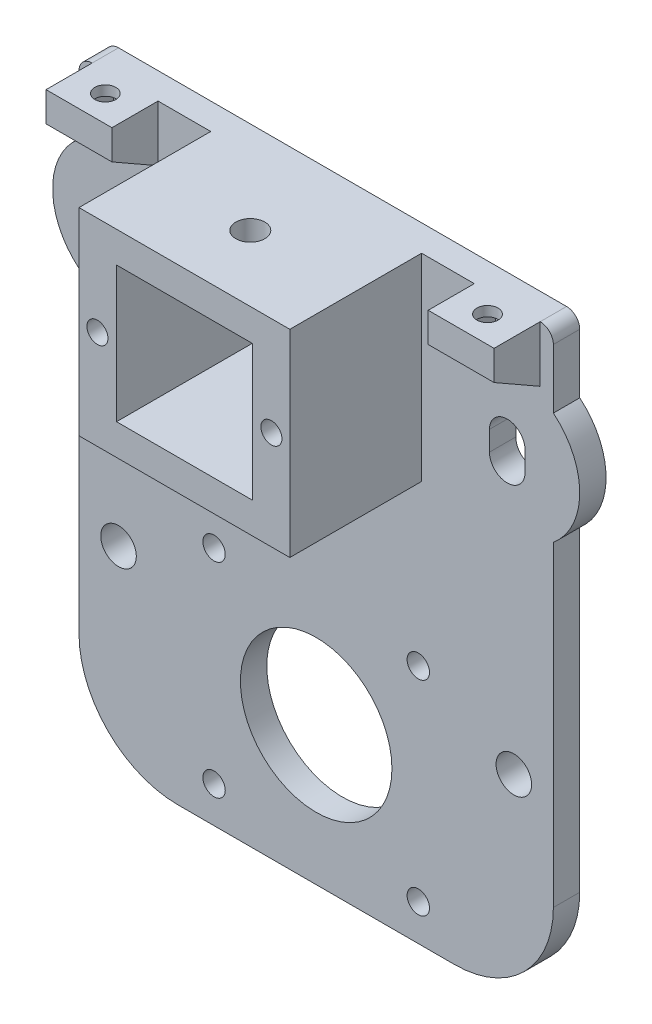
from build123d import *

# Parameters (mm, degrees)
SKETCH_1_R          = 1.7
SKETCH_1_R_2        = 11.5
SKETCH_1_R_3        = 2.7
SKETCH_1_R_4        = 1.6
SKETCH_1_W          = 20.6
SKETCH_1_H          = 20.6
EXTRUDE_1_DEPTH     = 4
EXTRUDE_START       = 4
SKETCH_1_3_W        = 10
SKETCH_1_3_H        = 4.5
EXTRUDE_2_DEPTH     = 7
SKETCH_1_4_W        = 32
SKETCH_1_4_H        = 30
SKETCH_1_4_R        = 1.6
SKETCH_1_4_W_2      = 20.6
SKETCH_1_4_H_2      = 20.6
EXTRUDE_3_DEPTH     = 20
RIB_1_REACH         = 94.748
SKETCH_3_WALL_W     = 195.558888446
SKETCH_3_WALL_H     = 1.7
RIB_2_REACH         = 86.984
SKETCH_4_WALL_W     = 180.029901728
SKETCH_4_WALL_H     = 1.7
CUT_EXTRUDE_1_REACH = 104.259
SKETCH_5_R          = 2.2
SKETCH_5_R_2        = 1.6
CUT_EXTRUDE_2_DEPTH = 3


with BuildPart() as part:
    # 草图1 → 凸台-拉伸1 (new body)
    with BuildSketch(Plane.XY):
        with BuildLine():
            ThreePointArc((36, 48.5), (35.414213562, 49.914213562), (34, 50.5))
            Line((34, 50.5), (-34, 50.5))
            ThreePointArc((-34, 50.5), (-35.414213562, 49.914213562), (-36, 48.5))
            Line((-36, 48.5), (-36, 39.485281374))
            ThreePointArc((-36, 39.485281374), (-40, 31), (-36, 22.514718626))
            Line((-36, 22.514718626), (-36, -25.5))
            ThreePointArc((-36, -25.5), (-31.606601718, -36.106601718), (-21, -40.5))
            Line((-21, -40.5), (21, -40.5))
            ThreePointArc((21, -40.5), (31.606601718, -36.106601718), (36, -25.5))
            Line((36, -25.5), (36, 22.514718626))
            ThreePointArc((36, 22.514718626), (40, 31), (36, 39.485281374))
            Line((36, 39.485281374), (36, 48.5))
        make_face()
        with Locations((-15.5, -35)):
            Circle(SKETCH_1_R, mode=Mode.SUBTRACT)
        with Locations((15.5, -35)):
            Circle(SKETCH_1_R, mode=Mode.SUBTRACT)
        with Locations((0, -19.5)):
            Circle(SKETCH_1_R_2, mode=Mode.SUBTRACT)
        with Locations((-30, -11)):
            Circle(SKETCH_1_R_3, mode=Mode.SUBTRACT)
        with Locations((-15.5, -4)):
            Circle(SKETCH_1_R, mode=Mode.SUBTRACT)
        with Locations((30, -11)):
            Circle(SKETCH_1_R_3, mode=Mode.SUBTRACT)
        with Locations((15.5, -4)):
            Circle(SKETCH_1_R, mode=Mode.SUBTRACT)
        with BuildLine():
            Line((-26.3, 32.5), (-26.3, 29.5))
            ThreePointArc((-26.3, 29.5), (-29, 26.8), (-31.7, 29.5))
            Line((-31.7, 29.5), (-31.7, 32.5))
            ThreePointArc((-31.7, 32.5), (-29, 35.2), (-26.3, 32.5))
        make_face(mode=Mode.SUBTRACT)
        with BuildLine():
            Line((31.7, 32.5), (31.7, 29.5))
            ThreePointArc((31.7, 29.5), (29, 26.8), (26.3, 29.5))
            Line((26.3, 29.5), (26.3, 32.5))
            ThreePointArc((26.3, 32.5), (29, 35.2), (31.7, 32.5))
        make_face(mode=Mode.SUBTRACT)
        with Locations((13.2, 35.5)):
            Circle(SKETCH_1_R_4, mode=Mode.SUBTRACT)
        with Locations((0, 35.5)):
            Rectangle(SKETCH_1_W, SKETCH_1_H, mode=Mode.SUBTRACT)
        with Locations((-13.2, 35.5)):
            Circle(SKETCH_1_R_4, mode=Mode.SUBTRACT)
    extrude(amount=EXTRUDE_1_DEPTH)

    # 草图1<3> → 凸台-拉伸2 (add)
    with BuildSketch(Plane.XY.offset(EXTRUDE_START)):
        with Locations((-29, 48.25)):
            Rectangle(SKETCH_1_3_W, SKETCH_1_3_H)
        with Locations((29, 48.25)):
            Rectangle(SKETCH_1_3_W, SKETCH_1_3_H)
    extrude(amount=EXTRUDE_2_DEPTH)

    # 草图1<4> → 凸台-拉伸3 (add)
    with BuildSketch(Plane.XY.offset(EXTRUDE_START)):
        with Locations((0, 35.5)):
            Rectangle(SKETCH_1_4_W, SKETCH_1_4_H)
        with Locations((-13.2, 35.5)):
            Circle(SKETCH_1_4_R, mode=Mode.SUBTRACT)
        with Locations((0, 35.5)):
            Rectangle(SKETCH_1_4_W_2, SKETCH_1_4_H_2, mode=Mode.SUBTRACT)
        with Locations((13.2, 35.5)):
            Circle(SKETCH_1_4_R, mode=Mode.SUBTRACT)
    extrude(amount=EXTRUDE_3_DEPTH)

    # 草图3 wall → 筋1 (add, up to next)
    with BuildSketch(Plane(origin=(-34, 44, 7.5), x_dir=(0, -0.496138938357, -0.868243142124), z_dir=(0, -0.868243142124, 0.496138938357)), mode=Mode.PRIVATE) as rib_1_sk1:
        with Locations((0, 0.85)):
            Rectangle(SKETCH_3_WALL_W, SKETCH_3_WALL_H)
    rib_1_tool1 = extrude(rib_1_sk1.sketch, amount=-RIB_1_REACH, mode=Mode.PRIVATE) - part.part
    rib_1 = rib_1_tool1.solids().sort_by_distance((-34, 44, 7.5))[0]
    add(rib_1)

    # 草图4 wall → 筋2 (add, up to next)
    with BuildSketch(Plane(origin=(-24, 44, 7.5), x_dir=(0, -0.496138938357, -0.868243142124), z_dir=(0, 0.868243142124, -0.496138938357)), mode=Mode.PRIVATE) as rib_2_sk1:
        with Locations((0, 0.85)):
            Rectangle(SKETCH_4_WALL_W, SKETCH_4_WALL_H)
    rib_2_tool1 = extrude(rib_2_sk1.sketch, amount=RIB_2_REACH, mode=Mode.PRIVATE) - part.part
    rib_2 = rib_2_tool1.solids().sort_by_distance((-24, 44, 7.5))[0]
    add(rib_2)

    # 镜向1: 筋1, 筋2 across plane
    add(rib_1.mirror(Plane(origin=(0, 0, 0), x_dir=(0, 0, 1), z_dir=(1, 0, 0))))
    add(rib_2.mirror(Plane(origin=(0, 0, 0), x_dir=(0, 0, 1), z_dir=(1, 0, 0))))

    # 草图5 → 切除-拉伸1 (cut, up to next)
    with BuildSketch(Plane(origin=(0, 50.5, 0), x_dir=(1, 0, 0), z_dir=(0, 1, 0)), mode=Mode.PRIVATE) as cut_extrude_1_sk1:
        with Locations(Location((0, -14, 0), (0, 0, 270))):
            Circle(SKETCH_5_R)
    cut_extrude_1_tool1 = extrude(cut_extrude_1_sk1.sketch, amount=-CUT_EXTRUDE_1_REACH, mode=Mode.PRIVATE) & part.part
    # 草图5 → 切除-拉伸1 (cut, up to next)
    with BuildSketch(Plane(origin=(0, 50.5, 0), x_dir=(1, 0, 0), z_dir=(0, 1, 0)), mode=Mode.PRIVATE) as cut_extrude_1_sk2:
        with Locations(Location((29, -7, 0), (0, 0, 270))):
            Circle(SKETCH_5_R_2)
    cut_extrude_1_tool2 = extrude(cut_extrude_1_sk2.sketch, amount=-CUT_EXTRUDE_1_REACH, mode=Mode.PRIVATE) & part.part
    # 草图5 → 切除-拉伸1 (cut, up to next)
    with BuildSketch(Plane(origin=(0, 50.5, 0), x_dir=(1, 0, 0), z_dir=(0, 1, 0)), mode=Mode.PRIVATE) as cut_extrude_1_sk3:
        with Locations(Location((-29, -7, 0), (0, 0, 270))):
            Circle(SKETCH_5_R_2)
    cut_extrude_1_tool3 = extrude(cut_extrude_1_sk3.sketch, amount=-CUT_EXTRUDE_1_REACH, mode=Mode.PRIVATE) & part.part
    add(cut_extrude_1_tool1.solids().sort_by_distance((0, 50.5, 14))[0], mode=Mode.SUBTRACT)
    add(cut_extrude_1_tool2.solids().sort_by_distance((29, 50.5, 7))[0], mode=Mode.SUBTRACT)
    add(cut_extrude_1_tool3.solids().sort_by_distance((-29, 50.5, 7))[0], mode=Mode.SUBTRACT)

    # 草图6 → 切除-拉伸2 (cut)
    with BuildSketch(Plane.XZ.offset(-46)):
        Polygon((-27.325684219, 9.9), (-30.674315781, 9.9), (-32.348631561, 7), (-30.674315781, 4.1), (-27.325684219, 4.1), (-25.651368439, 7), align=None)
        Polygon((32.348631561, 7), (30.674315781, 9.9), (27.325684219, 9.9), (25.651368439, 7), (27.325684219, 4.1), (30.674315781, 4.1), align=None)
    extrude(amount=-CUT_EXTRUDE_2_DEPTH, mode=Mode.SUBTRACT)


solid = part.part
